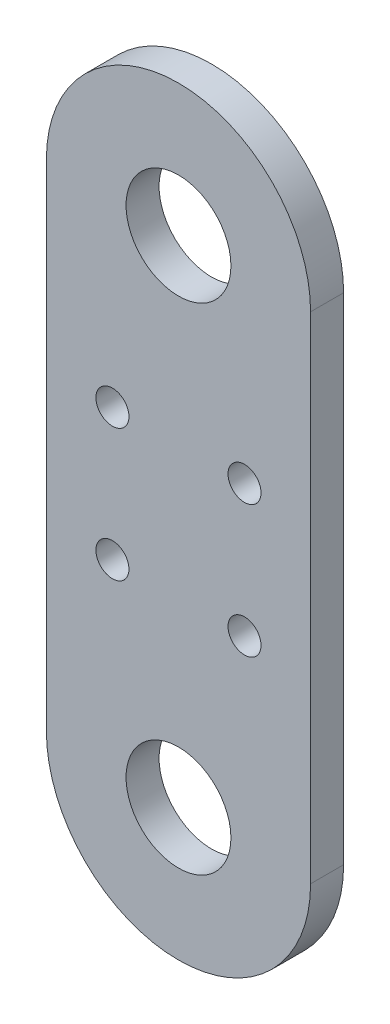
from build123d import *

# Parameters (mm, degrees)
BOSS_EXTRUDE1_DEPTH          = 3.175
F_3_8_CLEARANCE_HOLE2_D      = 10.0838
F_1_8_0_125_DIAMETER_HOLE1_D = 3.175


with BuildPart() as part:
    # Sketch1 → Boss-Extrude1 (new body)
    with BuildSketch(Plane.XY):
        with BuildLine():
            Line((-12.7, -23.8125), (-12.7, 23.8125))
            ThreePointArc((-12.7, 23.8125), (0, 36.5125), (12.7, 23.8125))
            Line((12.7, 23.8125), (12.7, -23.8125))
            ThreePointArc((12.7, -23.8125), (0, -36.5125), (-12.7, -23.8125))
        make_face()
    extrude(amount=BOSS_EXTRUDE1_DEPTH)

    # 3/8 Clearance Hole2 (through all)
    with Locations(Plane.XY.offset(3.175)):
        with Locations((0, 23.8125), (0, -23.8125)):
            Hole(F_3_8_CLEARANCE_HOLE2_D / 2)

    # 1/8 (0.125) Diameter Hole1 (through all)
    with Locations(Plane.XY.offset(3.175)):
        with Locations((6.35, -6.35), (6.35, 6.35), (-6.35, -6.35), (-6.35, 6.35)):
            Hole(F_1_8_0_125_DIAMETER_HOLE1_D / 2)


solid = part.part
